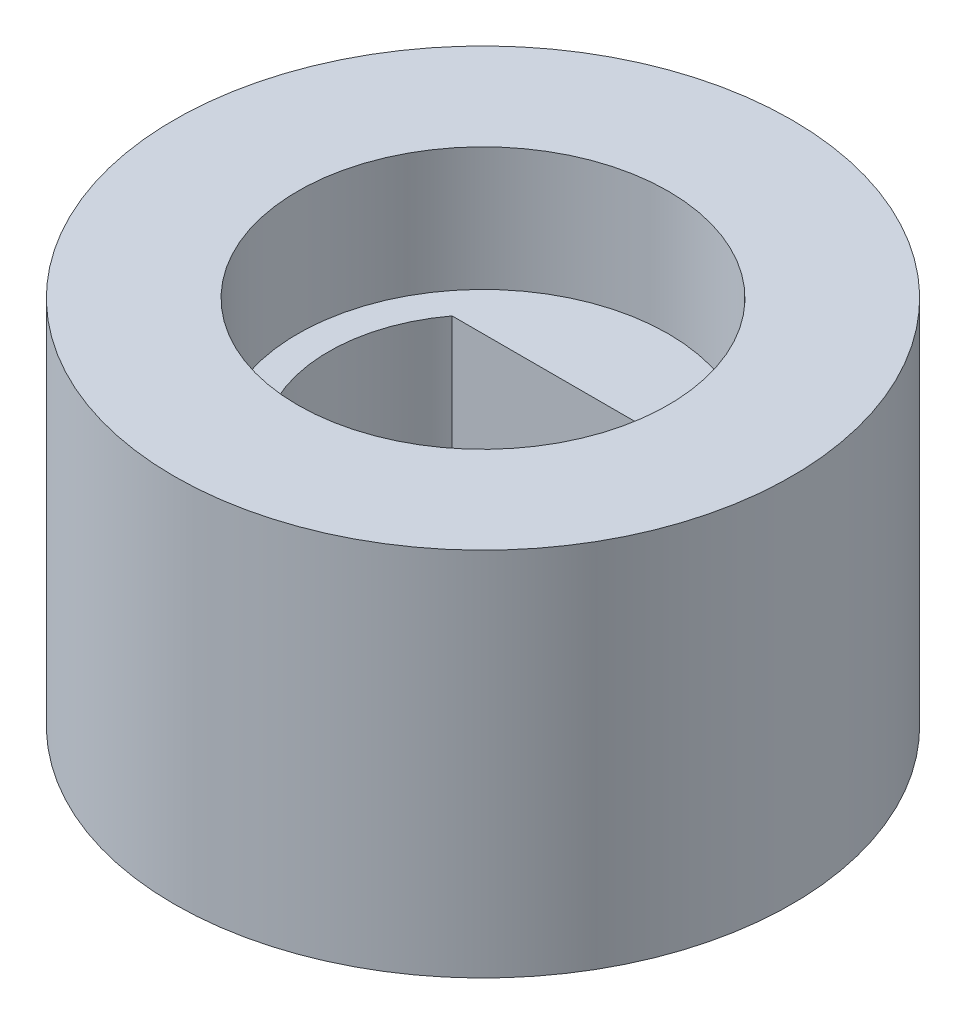
from build123d import *

# Parameters (mm, degrees)
SKETCH_1_R      = 5
SKETCH_1_R_2    = 3
EXTRUDE_1_DEPTH = 4
EXTRUDE_START   = 4
SKETCH_1_3_R    = 5
SKETCH_1_3_R_2  = 3
EXTRUDE_2_DEPTH = 2


with BuildPart() as part:
    # 草图1 → 凸台-拉伸1 (new body)
    # profile 1 of 2: a face of its own
    with BuildSketch(Plane(origin=(0, 0, 0), x_dir=(1, 0, 0), z_dir=(0, 1, 0))):
        with Locations(Location((0, 0, 0), (0, 0, 270))):
            Circle(SKETCH_1_R)
        with Locations(Location((0, 0, 0), (0, 0, 270))):
            Circle(SKETCH_1_R_2, mode=Mode.SUBTRACT)
    # profile 2 of 2: a face of its own
    with BuildSketch(Plane(origin=(0, 0, 0), x_dir=(1, 0, 0), z_dir=(0, 1, 0))):
        with Locations(Location((0, 0, 0), (0, 0, 270))):
            Circle(SKETCH_1_R_2)
        with BuildLine():
            ThreePointArc((-2, 1.5), (0, -2.5), (2, 1.5))
            Line((2, 1.5), (-2, 1.5))
        make_face(mode=Mode.SUBTRACT)
    extrude(amount=EXTRUDE_1_DEPTH)

    # 草图1<3> → 凸台-拉伸2 (add)
    with BuildSketch(Plane(origin=(0, 0, 0), x_dir=(1, 0, 0), z_dir=(0, 1, 0)).offset(EXTRUDE_START)):
        with Locations(Location((0, 0, 0), (0, 0, 270))):
            Circle(SKETCH_1_3_R)
        with Locations(Location((0, 0, 0), (0, 0, 270))):
            Circle(SKETCH_1_3_R_2, mode=Mode.SUBTRACT)
    extrude(amount=EXTRUDE_2_DEPTH)


solid = part.part
